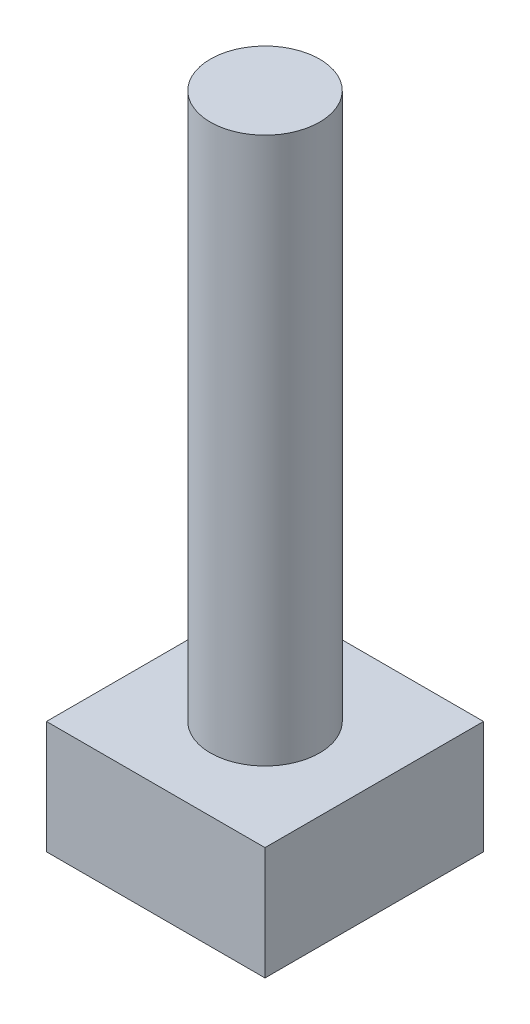
from build123d import *

# Parameters (mm, degrees)
SKETCH_1_W      = 6
SKETCH_1_H      = 6
EXTRUDE_1_DEPTH = 3.1
SKETCH_2_R      = 1.5
EXTRUDE_2_DEPTH = 15


with BuildPart() as part:
    # 草图1 → 拉伸1 (new body)
    with BuildSketch(Plane(origin=(0, 0, 0), x_dir=(1, 0, 0), z_dir=(0, 1, 0))):
        Rectangle(SKETCH_1_W, SKETCH_1_H)
    extrude(amount=EXTRUDE_1_DEPTH)

    # 草图2 → 拉伸2 (add)
    with BuildSketch(Plane(origin=(0, 3.1, 0), x_dir=(-1, 0, 0), z_dir=(0, 1, 0))):
        with Locations(Location((0, 0, 0), (0, 0, 90))):
            Circle(SKETCH_2_R)
    extrude(amount=EXTRUDE_2_DEPTH)


solid = part.part
